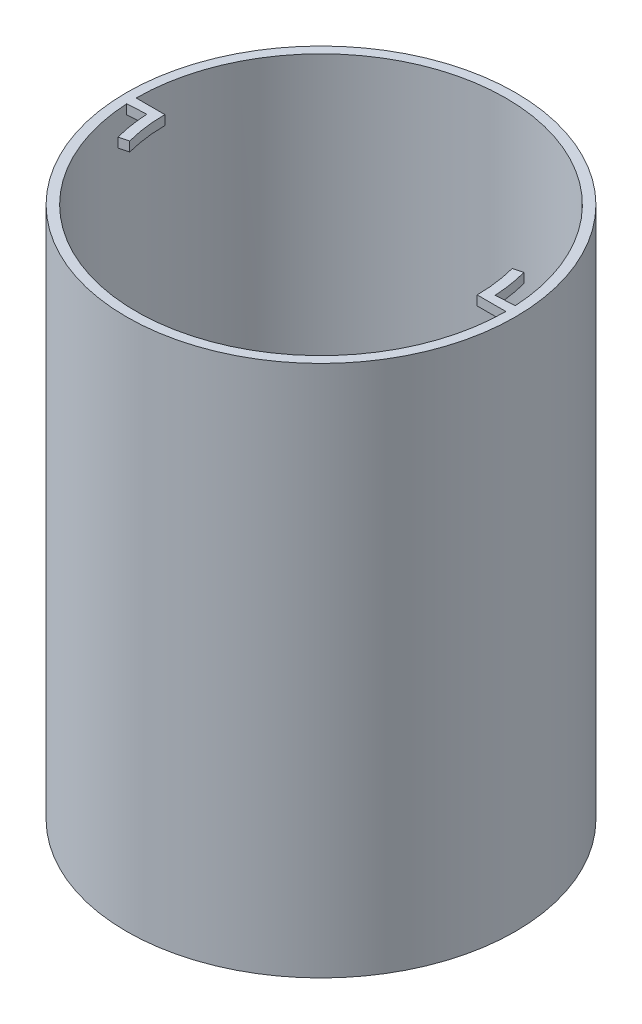
from build123d import *

# Parameters (mm, degrees)
SKETCH1_W      = 3
SKETCH1_H      = 167
SKETCH2_W      = 6
SKETCH2_H      = 3
REVOLVE2_ANGLE = 3
SKETCH3_W      = 3
SKETCH3_H      = 3
REVOLVE3_ANGLE = 15


with BuildPart() as part:
    # Sketch1 → Revolve1 (revolve)
    with BuildSketch(Plane.XY, mode=Mode.PRIVATE) as revolve1_sk:
        with Locations((59.5, 83.5)):
            Rectangle(SKETCH1_W, SKETCH1_H)
    revolve(revolve1_sk.sketch.rotate(Axis((0, 0, 0), (0, 1, 0)), 90), axis=Axis((0, 0, 0), (0, 1, 0)))

    # Sketch2 → Revolve2 (revolve)
    with BuildSketch(Plane.XY):
        with Locations((-55, 165.5)):
            Rectangle(SKETCH2_W, SKETCH2_H)
        with Locations((55, 165.5)):
            Rectangle(SKETCH2_W, SKETCH2_H)
    revolve(axis=Axis((0, 0, 0), (0, 1, 0)), revolution_arc=REVOLVE2_ANGLE)

    # Sketch3 → Revolve3 (revolve)
    with BuildSketch(Plane.XY):
        with Locations((-50.5, 165.5)):
            Rectangle(SKETCH3_W, SKETCH3_H)
        with Locations((50.5, 165.5)):
            Rectangle(SKETCH3_W, SKETCH3_H)
    revolve(axis=Axis((0, 0, 0), (0, 1, 0)), revolution_arc=REVOLVE3_ANGLE)


solid = part.part
